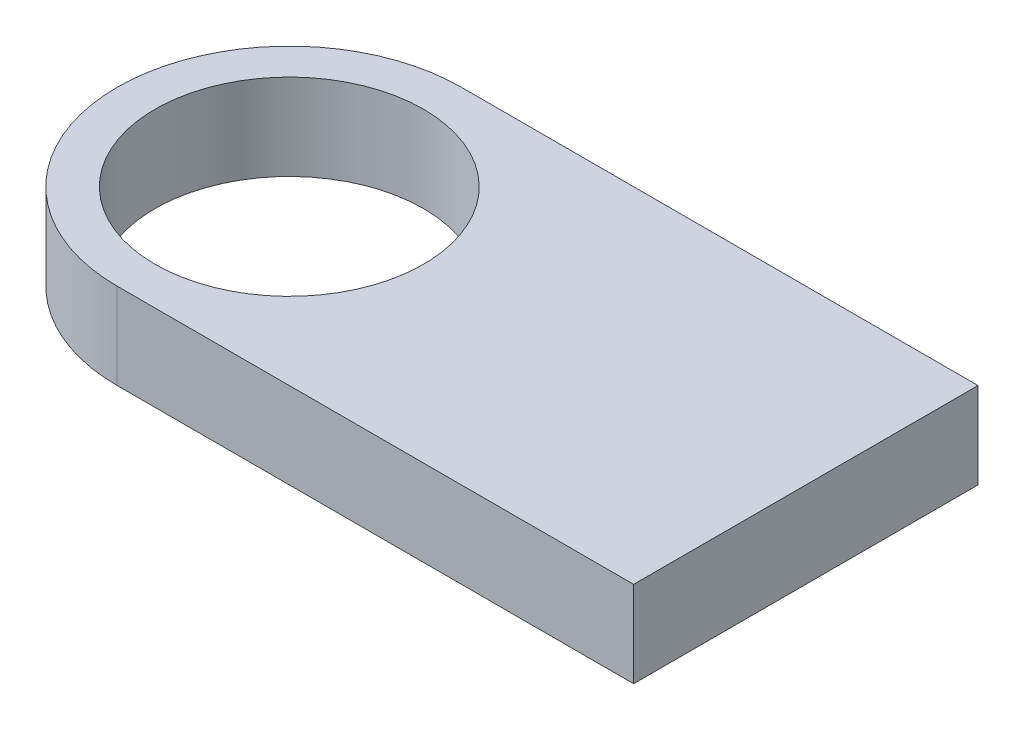
from build123d import *

# Parameters (mm, degrees)
SALIENTE_EXTRUIR1_DEPTH = 5
CROQUIS2_R              = 7.8
CORTAR_EXTRUIR1_DEPTH   = 5


with BuildPart() as part:
    # Croquis1 → Saliente-Extruir1 (new body)
    with BuildSketch(Plane(origin=(0, 0, 0), x_dir=(1, 0, 0), z_dir=(0, 1, 0))):
        with BuildLine():
            Line((0, -10), (30, -10))
            Line((30, -10), (30, 10))
            Line((30, 10), (0, 10))
            ThreePointArc((0, 10), (-10, 0), (0, -10))
        make_face()
    extrude(amount=SALIENTE_EXTRUIR1_DEPTH)

    # Croquis2 → Cortar-Extruir1 (cut)
    with BuildSketch(Plane(origin=(0, 5, 0), x_dir=(1, 0, 0), z_dir=(0, 1, 0))):
        with Locations(Location((0, 0, 0), (0, 0, 270))):
            Circle(CROQUIS2_R)
    extrude(amount=-CORTAR_EXTRUIR1_DEPTH, mode=Mode.SUBTRACT)


solid = part.part
